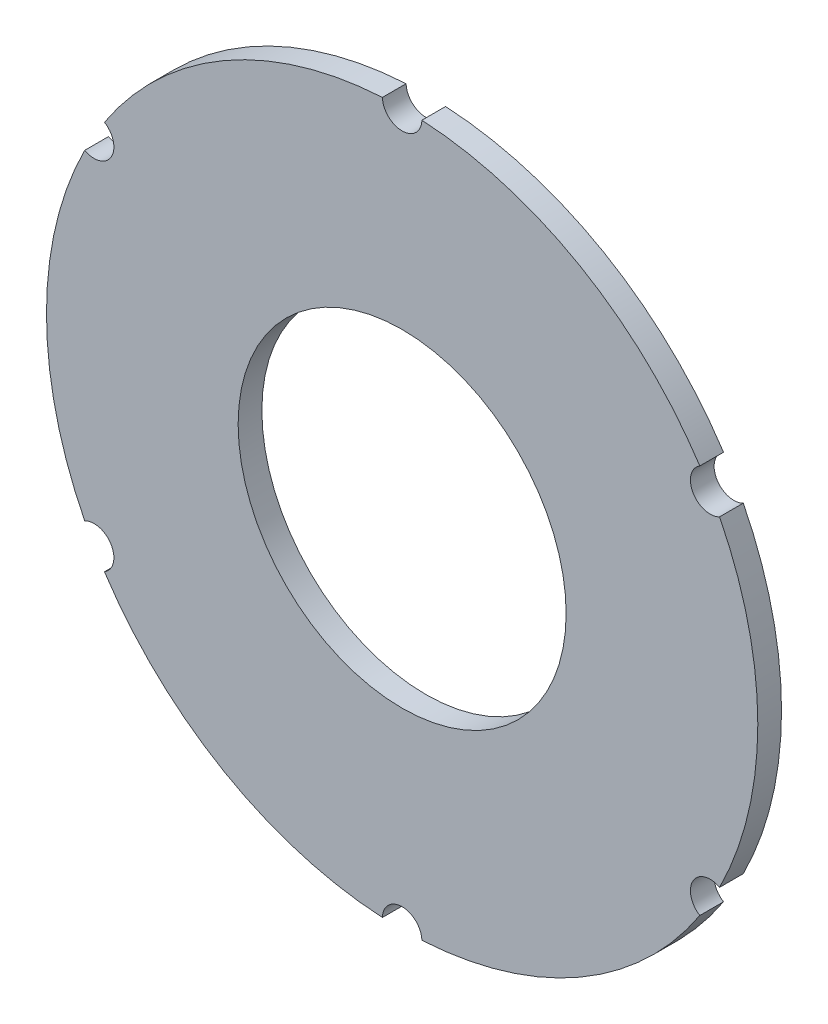
from build123d import *

# Parameters (mm, degrees)
SKETCH1_R                  = 90
SKETCH1_R_2                = 41.5
BOSS_EXTRUDE1_DEPTH        = 6
F_10_0MM_DOWEL_HOLE1_D     = 10
F_10_0MM_DOWEL_HOLE1_DEPTH = 9.906
F_10_0MM_DOWEL_HOLE1_TIP   = 3.004303095


with BuildPart() as part:
    # Sketch1 → Boss-Extrude1 (new body)
    with BuildSketch(Plane.XY):
        Circle(SKETCH1_R)
        Circle(SKETCH1_R_2, mode=Mode.SUBTRACT)
    extrude(amount=BOSS_EXTRUDE1_DEPTH)

    # Ø10.0mm Dowel Hole1
    with Locations(Plane(origin=(0, 0, 0), x_dir=(-1, 0, 0), z_dir=(0, 0, -1))):
        with Locations((-77.942286341, 45), (-77.942286341, -45), (0, -90), (77.942286341, -45), (77.942286341, 45), (0, 90)):
            Hole(F_10_0MM_DOWEL_HOLE1_D / 2, depth=F_10_0MM_DOWEL_HOLE1_DEPTH)
            with Locations((0, 0, -(F_10_0MM_DOWEL_HOLE1_DEPTH + F_10_0MM_DOWEL_HOLE1_TIP / 2))):  # 118° drill point
                Cone(0, F_10_0MM_DOWEL_HOLE1_D / 2, F_10_0MM_DOWEL_HOLE1_TIP, mode=Mode.SUBTRACT)


solid = part.part
